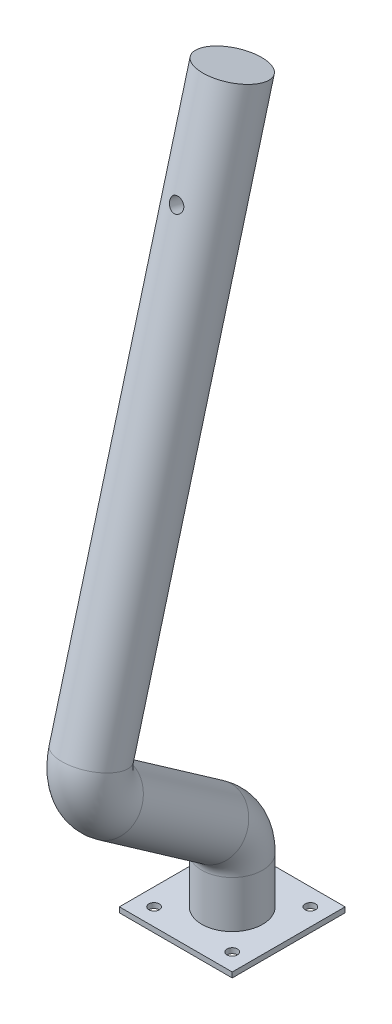
from build123d import *

# Parameters (mm, degrees)
SKETCH_1_W          = 65
SKETCH_1_H          = 65
SKETCH_1_R          = 3
EXTRUDE_1_DEPTH     = 3
SWEEP_1_PROFILE_R   = 17.5
SKETCH_31_R         = 4
CUT_EXTRUDE_1_DEPTH = 50


with BuildPart() as part:
    # 草图1 → 凸台-拉伸1 (new body)
    with BuildSketch(Plane(origin=(0, 0, 0), x_dir=(1, 0, 0), z_dir=(0, 1, 0))):
        Rectangle(SKETCH_1_W, SKETCH_1_H)
        with Locations(Location((22.5, -22.5, 0), (0, 0, 270))):
            Circle(SKETCH_1_R, mode=Mode.SUBTRACT)
        with Locations(Location((-22.5, -22.5, 0), (0, 0, 270))):
            Circle(SKETCH_1_R, mode=Mode.SUBTRACT)
        with Locations(Location((-22.5, 22.5, 0), (0, 0, 270))):
            Circle(SKETCH_1_R, mode=Mode.SUBTRACT)
        with Locations(Location((22.5, 22.5, 0), (0, 0, 270))):
            Circle(SKETCH_1_R, mode=Mode.SUBTRACT)
    extrude(amount=EXTRUDE_1_DEPTH)

    # 扫描1: sweep along a path in 草图2
    with BuildLine(Plane(origin=(0, 0, 0), x_dir=(0, 0, -1), z_dir=(1, 0, 0))) as sweep_1_path:
        Line((0, 3), (0, 29.985823736))
        ThreePointArc((0, 29.985823736), (-2.824729171, 41.529539067), (-10.660589091, 50.464624843))
        Line((-10.660589091, 50.464624843), (-71.349469496, 92.959436388))
        ThreePointArc((-71.349469496, 92.959436388), (-80.502374107, 104.887733912), (-81.158204244, 119.908713623))
        Line((-81.158204244, 119.908713623), (0, 422.795255313))
    # 扫描1 profile (on start of the path) → 扫描1 (sweep)
    with BuildSketch(Plane.ZX.offset(3)):
        Circle(SWEEP_1_PROFILE_R)
    sweep(path=sweep_1_path.line)

    # 草图31 → 切除-拉伸1 (cut)
    with BuildSketch(Plane(origin=(0, 28.321911806, 105.698813828), x_dir=(0, 0.9659258262890683, -0.2588190451025209), z_dir=(0, -0.2588190451025209, -0.9659258262890683))):
        with Locations((348.38885634, 0)):
            Circle(SKETCH_31_R)
    extrude(amount=-CUT_EXTRUDE_1_DEPTH, mode=Mode.SUBTRACT)


solid = part.part
